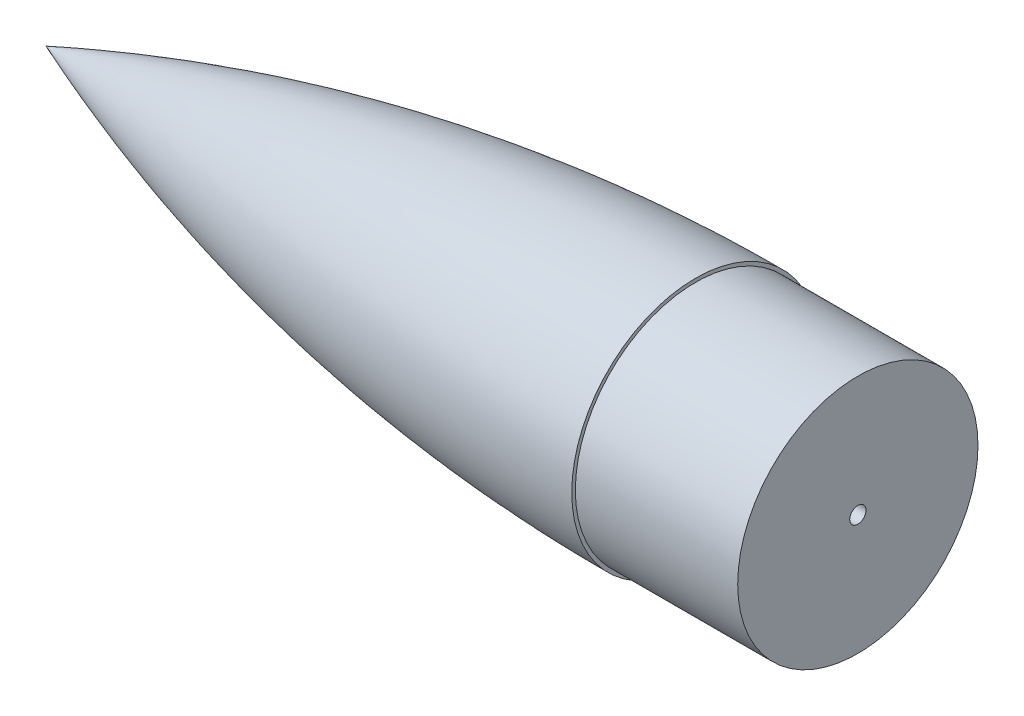
from build123d import *

# Parameters (mm, degrees)
SKETCH10_R          = 37
BOSS_EXTRUDE1_DEPTH = 50
SKETCH11_R          = 2.5
CUT_EXTRUDE1_DEPTH  = 25


with BuildPart() as part:
    # Sketch3 → Revolve1 (revolve)
    with BuildSketch(Plane.XY):
        with BuildLine():
            Line((0, 0), (200, 0))
            Line((200, 0), (200, 38.1))
            add(Edge.make_bspline(
                [(0, 0), (0.333278549, 0.131540873), (0.999577039, 0.394520549), (1.999623692, 0.786334891), (2.999614377, 1.17601578), (4.66502861, 1.821148753), (7.328741847, 2.840985756), (11.325969227, 4.339896645), (15.327567951, 5.800346847), (21.648365914, 8.05135545), (32.594864134, 11.782666432), (44.617809557, 15.495925888), (54.658642309, 18.334838057), (59.993667814, 19.782959156), (64.329338058, 20.915666696), (68.662820277, 22.01269926), (73.990330688, 23.318521745), (78.993971117, 24.479998264), (83.997331558, 25.591796678), (87.330083915, 26.309365893), (93.324657038, 27.552988579), (99.987226118, 28.850738677), (109.652181507, 30.574297106), (118.320286798, 31.962202042), (124.997544263, 32.910660178), (132.98954992, 33.985397902), (141.318339795, 34.97224064), (150.663527404, 35.869691178), (156.997734153, 36.407242182), (166.989872456, 37.153259543), (176.661040051, 37.642869627), (186.332724985, 37.936353666), (190.666251166, 38.027993755), (194.333291829, 38.071814955), (195.999993248, 38.085597183), (196.999994924, 38.092040964), (197.999996625, 38.09660679), (198.999998309, 38.099469797), (199.666666479, 38.099823266), (200, 38.1)],
                knots=[0, 0, 0, 0, 0.005248402, 0.010492732, 0.015733018, 0.020969291, 0.036654322, 0.057513275, 0.083502072, 0.099051411, 0.155796901, 0.252897726, 0.283342643, 0.308639705, 0.333872761, 0.348983013, 0.37411934, 0.414220017, 0.424223641, 0.44919678, 0.464156839, 0.513902353, 0.54862082, 0.607960951, 0.642483277, 0.647409944, 0.726082727, 0.765324507, 0.784925615, 0.819199979, 0.912095095, 0.926749999, 0.960936877, 0.975586084, 0.980468966, 0.985351783, 0.990234549, 0.995117283, 1, 1, 1, 1], degree=3))
        make_face()
    revolve(axis=Axis((0, 0, 0), (1, 0, 0)))

    # Sketch10 → Boss-Extrude1 (add)
    with BuildSketch(Plane(origin=(200, 0, 0), x_dir=(0, 0, -1), z_dir=(1, 0, 0))):
        with Locations(Location((0, 0, 0), (0, 0, 180))):
            Circle(SKETCH10_R)
    extrude(amount=BOSS_EXTRUDE1_DEPTH)

    # Sketch11 → Cut-Extrude1 (cut)
    with BuildSketch(Plane(origin=(250, 0, 0), x_dir=(0, 0, -1), z_dir=(1, 0, 0))):
        Circle(SKETCH11_R)
    extrude(amount=-CUT_EXTRUDE1_DEPTH, mode=Mode.SUBTRACT)


solid = part.part
